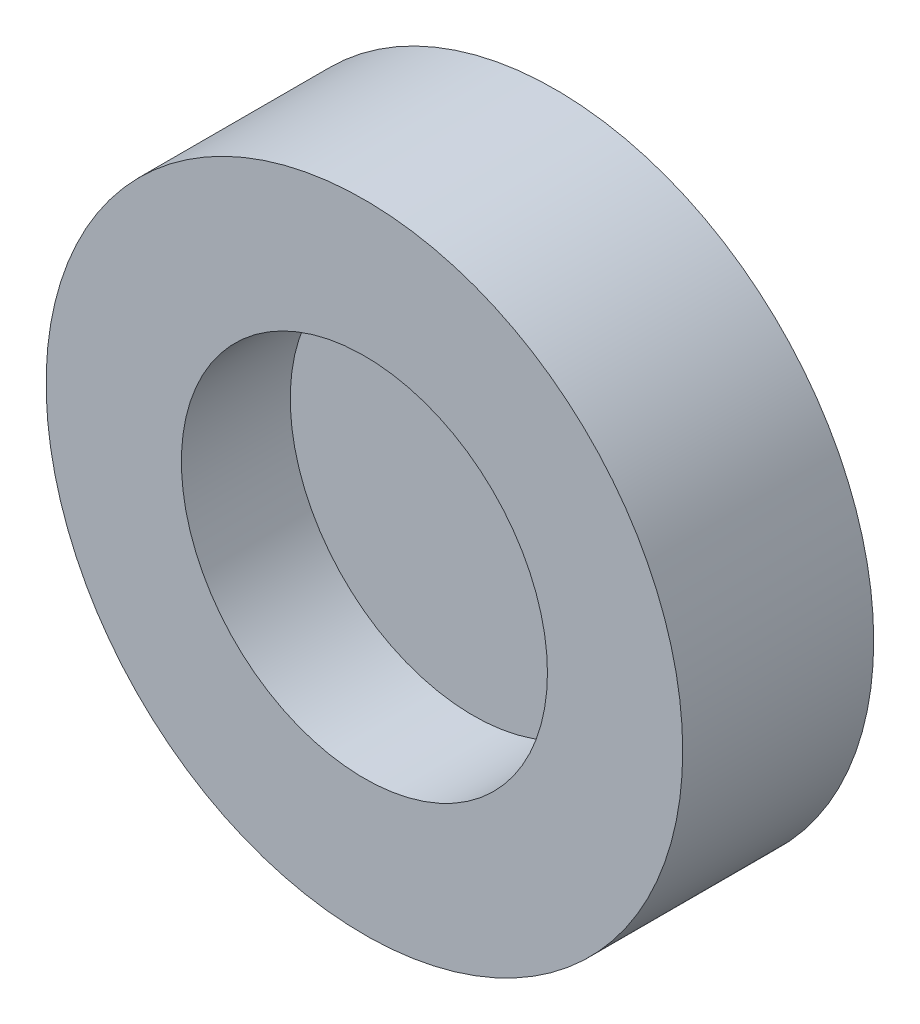
from build123d import *

# Parameters (mm, degrees)
EXTRUDE_START       = -13.438867
SKETCH_1_R          = 10
EXTRUDE_1_DEPTH     = 6
SKETCH_2_R          = 5.75
CUT_EXTRUDE_1_DEPTH = 3.42


with BuildPart() as part:
    # 草图1 → 凸台-拉伸1 (new body)
    with BuildSketch(Plane.XY.offset(EXTRUDE_START)):
        with Locations((-113.723326446, 27.970784046)):
            Circle(SKETCH_1_R)
    extrude(amount=-EXTRUDE_1_DEPTH)

    # 草图2 → 切除-拉伸1 (cut)
    with BuildSketch(Plane.XY.offset(-13.43886688)):
        with Locations((-113.723326446, 27.970784046)):
            Circle(SKETCH_2_R)
    extrude(amount=-CUT_EXTRUDE_1_DEPTH, mode=Mode.SUBTRACT)


solid = part.part
